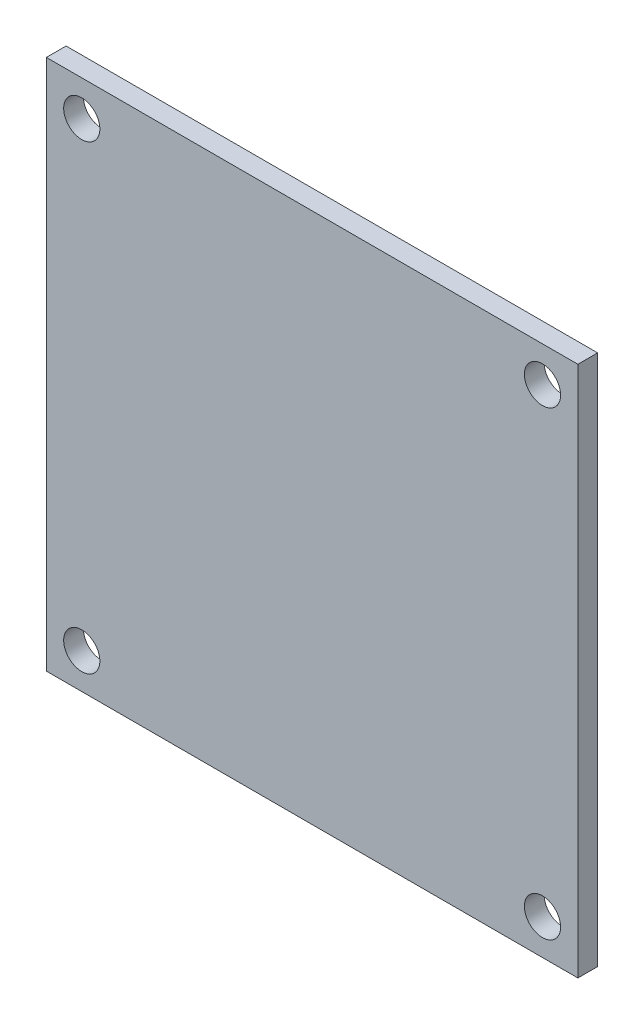
from build123d import *

# Parameters (mm, degrees)
PCB_1_2_START = 16.8
SKETCH_1_W    = 32.3
SKETCH_1_H    = 32.3
PCB_1_2_DEPTH = 1.2
PCB_START     = 16.8
SKETCH_2_R    = 1.1
PCB_DEPTH     = 1.2


with BuildPart() as part:
    # 草图1 → PCB装配包络_厚1.2 (new body)
    with BuildSketch(Plane.XY.offset(PCB_1_2_START)):
        Rectangle(SKETCH_1_W, SKETCH_1_H)
    extrude(amount=PCB_1_2_DEPTH)

    # 草图2 → 原厂PCB孔径_非打印放孔 (cut)
    with BuildSketch(Plane.XY.offset(PCB_START)):
        with Locations((-14, -14)):
            Circle(SKETCH_2_R)
        with Locations((-14, 14)):
            Circle(SKETCH_2_R)
        with Locations((14, -14)):
            Circle(SKETCH_2_R)
        with Locations((14, 14)):
            Circle(SKETCH_2_R)
    extrude(amount=PCB_DEPTH, mode=Mode.SUBTRACT)


solid = part.part
